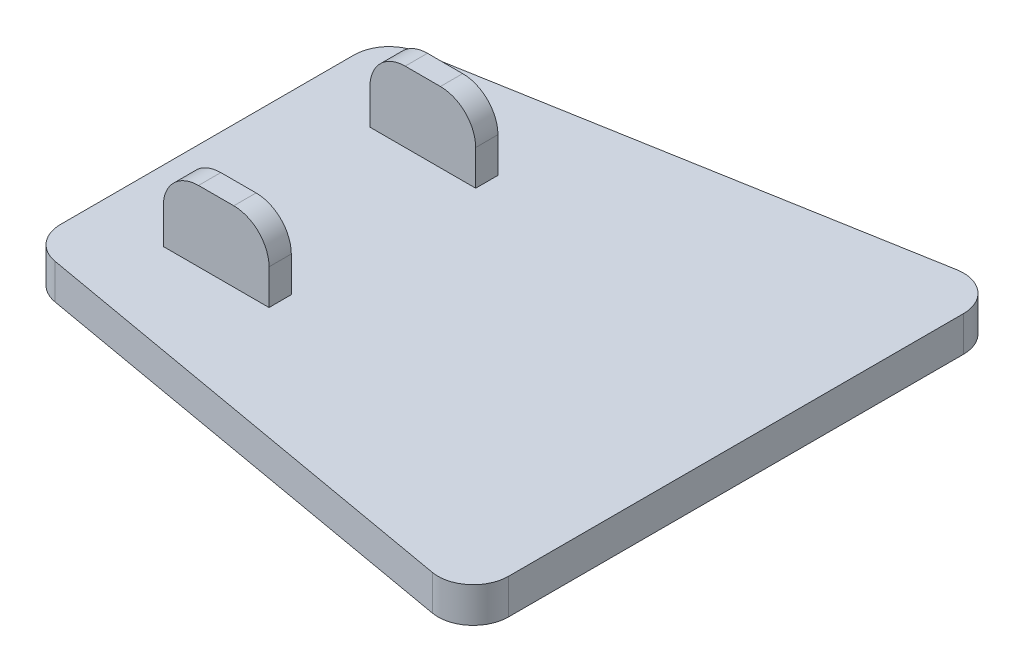
from build123d import *

# Parameters (mm, degrees)
BOSS_EXTRUDE1_DEPTH = 10
SKETCH2_W           = 30
SKETCH2_H           = 6.318939308
BOSS_EXTRUDE2_DEPTH = 20
FILLET2_R           = 10
FILLET3_R           = 10


with BuildPart() as part:
    # Sketch1 → Boss-Extrude1 (new body)
    with BuildSketch(Plane(origin=(0, 0, 0), x_dir=(1, 0, 0), z_dir=(0, 1, 0))):
        Polygon((0, 0), (0, 50), (150, 76.449047106), (150, -76.449047106), (0, -50), align=None)
    extrude(amount=BOSS_EXTRUDE1_DEPTH)

    # Sketch2 → Boss-Extrude2 (add)
    with BuildSketch(Plane(origin=(0, 10, 0), x_dir=(1, 0, 0), z_dir=(0, 1, 0))):
        with Locations((35, 29.313333891)):
            Rectangle(SKETCH2_W, SKETCH2_H)
    extrude(amount=BOSS_EXTRUDE2_DEPTH)

    # Fillet2
    fillet2_edges = [part.edges().sort_by_distance(p)[0] for p in [
        (20, 30, -29.313333891),
        (50, 30, -29.313333891),
    ]]
    fillet(fillet2_edges, radius=FILLET2_R)

    # Mirror1: part across plane


with BuildPart() as part_1:
    add(part.part)
    add(part.part.mirror(Plane.XY))

    # Fillet3
    fillet3_edges = [part_1.edges().sort_by_distance(p)[0] for p in [
        (150, 5, 76.449047106),
        (150, 5, -76.449047106),
        (0, 5, -50),
        (0, 5, 50),
    ]]
    fillet(fillet3_edges, radius=FILLET3_R)


solid = part_1.part
